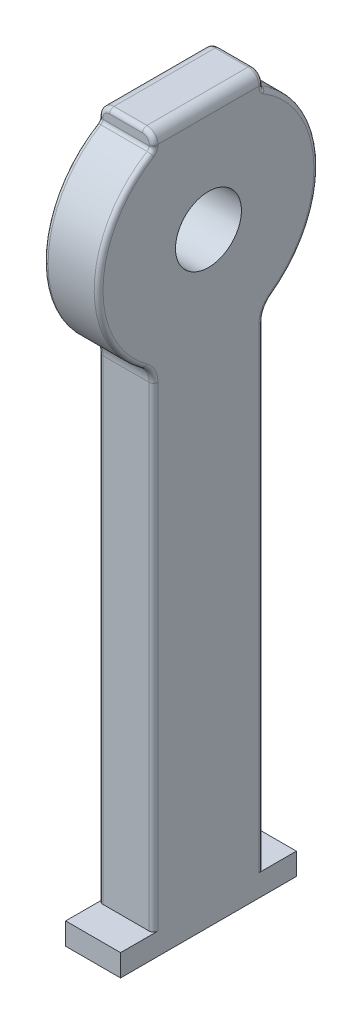
from build123d import *
from OCP.BRepFilletAPI import BRepFilletAPI_MakeFillet

# Parameters (mm, degrees)
SKETCH4_W           = 250
SKETCH4_H           = 500
BOSS_EXTRUDE3_DEPTH = 3250
SKETCH7_R           = 500
BOSS_EXTRUDE4_DEPTH = 250
SKETCH8_R           = 150
CUT_EXTRUDE1_DEPTH  = 250
FILLET1_R1          = 20
FILLET1_R2          = 50
FILLET1_R3          = 100
SKETCH10_W          = 250
SKETCH10_H          = 100
BOSS_EXTRUDE5_DEPTH = 400


with BuildPart() as part:
    # Sketch4 → Boss-Extrude3 (new body)
    with BuildSketch(Plane(origin=(0, 0, 0), x_dir=(1, 0, 0), z_dir=(0, 1, 0))):
        with Locations((1625, 0)):
            Rectangle(SKETCH4_W, SKETCH4_H)
    extrude(amount=BOSS_EXTRUDE3_DEPTH)

    # Sketch7 → Boss-Extrude4 (add)
    with BuildSketch(Plane.ZY.offset(-1500)):
        with Locations((0, 2750)):
            Circle(SKETCH7_R)
    extrude(amount=-BOSS_EXTRUDE4_DEPTH)

    # Sketch8 → Cut-Extrude1 (cut)
    with BuildSketch(Plane.ZY.offset(-1500)):
        with Locations((0, 2750)):
            Circle(SKETCH8_R)
    extrude(amount=-CUT_EXTRUDE1_DEPTH, mode=Mode.SUBTRACT)

    # Fillet1: one fillet with a radius per group of edges: ONE call of the kernel's fillet builder (fillet() takes one radius for all edges)
    fillet1_edges_1 = [part.edges().sort_by_distance(p)[0] for p in [
        (1500, 1158.493649054, -250),
        (1625, 3250, -250),
        (1750, 1158.493649054, -250),
        (1750, 1158.493649054, 250),
        (1500, 1158.493649054, 250),
        (1750, 2750, 500),
        (1750, 2750, -500),
        (1625, 3183.012701892, -250),
        (1500, 2750, 500),
        (1500, 2750, -500),
        (1625, 3183.012701892, 250),
        (1500, 3216.506350946, -250),
        (1750, 3216.506350946, -250),
        (1750, 3216.506350946, 250),
        (1500, 3216.506350946, 250),
        (1625, 3250, 250),
    ]]
    fillet1_edges_2 = [part.edges().sort_by_distance(p)[0] for p in [
        (1750, 3250, 0),
        (1500, 3250, 0),
    ]]
    fillet1_edges_3 = [part.edges().sort_by_distance(p)[0] for p in [
        (1625, 2316.987298108, 250),
        (1625, 2316.987298108, -250),
    ]]
    fillet1 = BRepFilletAPI_MakeFillet(part.part.solid().wrapped)
    for e in fillet1_edges_1:
        fillet1.Add(FILLET1_R1, e.wrapped)
    for e in fillet1_edges_2:
        fillet1.Add(FILLET1_R2, e.wrapped)
    for e in fillet1_edges_3:
        fillet1.Add(FILLET1_R3, e.wrapped)
    add(Compound.cast(fillet1.Shape()), mode=Mode.REPLACE)

    # Sketch10 → Boss-Extrude5 (add, symmetric)
    with BuildSketch(Plane.XY):
        with Locations((1625, 50)):
            Rectangle(SKETCH10_W, SKETCH10_H)
    extrude(amount=BOSS_EXTRUDE5_DEPTH, both=True)


solid = part.part
